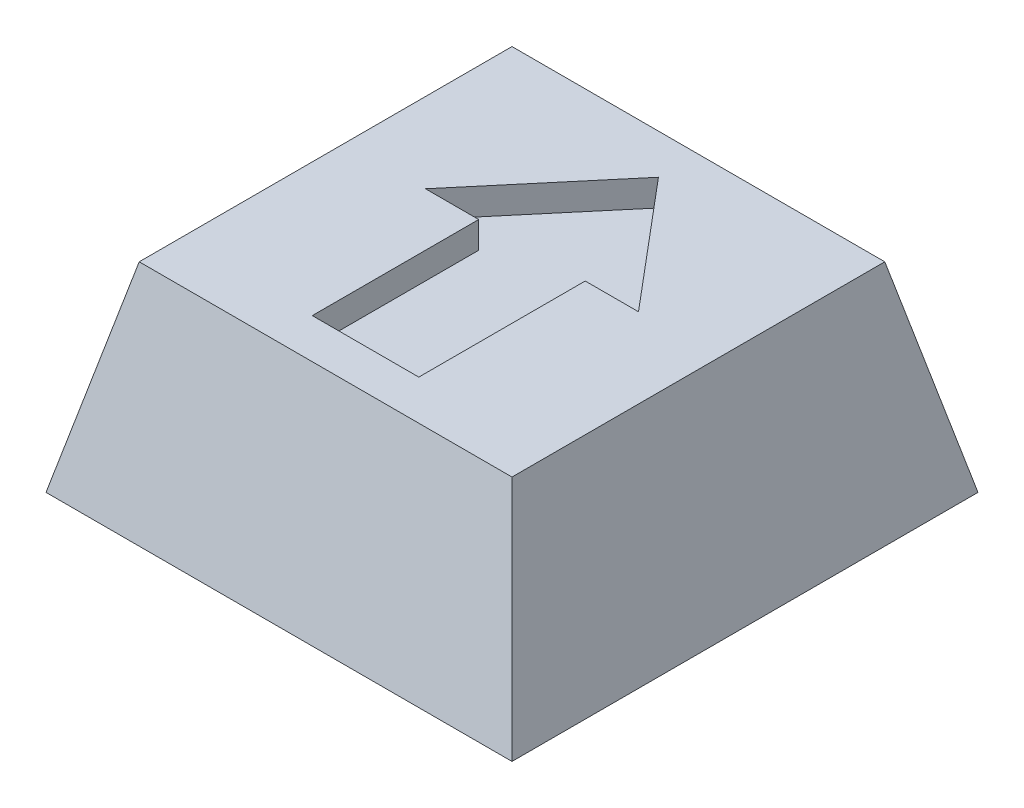
from build123d import *

# Parameters (mm, degrees)
SKETCH1_W           = 7
SKETCH1_H           = 7
BOSS_EXTRUDE1_DEPTH = 3
CUT_EXTRUDE1_DEPTH  = 7
CUT_EXTRUDE2_DEPTH  = 11
SKETCH4_R           = 1.8
CUT_EXTRUDE3_DEPTH  = 0.8
SKETCH5_W           = 1.6
SKETCH5_H           = 2.5
CUT_EXTRUDE4_DEPTH  = 0.4


with BuildPart() as part:
    # Sketch1 → Boss-Extrude1 (new body)
    with BuildSketch(Plane(origin=(0, 0, 0), x_dir=(1, 0, 0), z_dir=(0, 1, 0))):
        with Locations((3.5, 3.5)):
            Rectangle(SKETCH1_W, SKETCH1_H)
    extrude(amount=BOSS_EXTRUDE1_DEPTH)

    # Sketch2 → Cut-Extrude1 (cut)
    with BuildSketch(Plane.XY):
        Polygon((0, 0), (0.7, 3), (0, 3), align=None)
        Polygon((7, 0), (6.3, 3), (7, 3), align=None)
    extrude(amount=-CUT_EXTRUDE1_DEPTH, mode=Mode.SUBTRACT)

    # Sketch3 → Cut-Extrude2 (cut)
    with BuildSketch(Plane(origin=(0, 0, 0), x_dir=(0, 0, -1), z_dir=(1, 0, 0))):
        Polygon((0, 0), (0.7, 3), (0, 3), align=None)
        Polygon((7, 3), (6.3, 3), (7, 0), align=None)
    extrude(amount=CUT_EXTRUDE2_DEPTH, mode=Mode.SUBTRACT)

    # Sketch4 → Cut-Extrude3 (cut)
    with BuildSketch(Plane.XZ):
        with Locations(Location((3.5, -3.5, 0), (0, 0, 270))):
            Circle(SKETCH4_R)
    extrude(amount=-CUT_EXTRUDE3_DEPTH, mode=Mode.SUBTRACT)

    # Sketch5 → Cut-Extrude4 (cut)
    with BuildSketch(Plane(origin=(0, 3, 0), x_dir=(1, 0, 0), z_dir=(0, 1, 0))):
        Polygon((3.5, 5.7), (1.9, 3.8), (2.7, 3.8), (4.3, 3.8), (5.1, 3.8), align=None)
        with Locations((3.5, 2.55)):
            Rectangle(SKETCH5_W, SKETCH5_H)
    extrude(amount=-CUT_EXTRUDE4_DEPTH, mode=Mode.SUBTRACT)


solid = part.part
